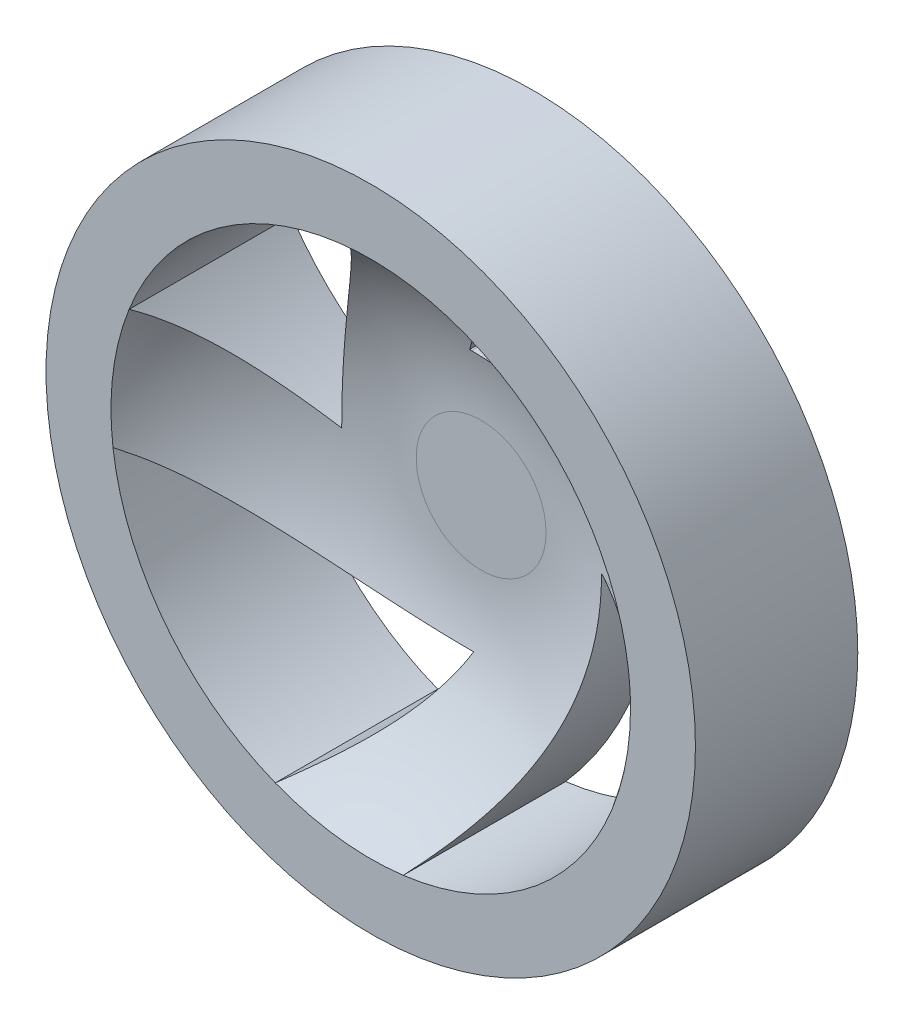
from build123d import *

# Parameters (mm, degrees)
SKETCH1_R           = 50
BOSS_EXTRUDE1_DEPTH = 25


with BuildPart() as part:
    # Sketch1 → Boss-Extrude1 (new body)
    with BuildSketch(Plane.XY):
        Circle(SKETCH1_R)
        with BuildLine():
            ThreePointArc((0, -20), (0.156254769, -19.999389602), (0.3125, -19.997558445))
            ThreePointArc((0.3125, -19.997558445), (-6.078152761, -29.5687044), (-14.6875, -37.205877812))
            ThreePointArc((-14.6875, -37.205877812), (-31.597964307, -24.526896495), (-39.686269666, -5))
            ThreePointArc((-39.686269666, -5), (-21.213203436, -16.124860802), (0, -20))
        make_face(mode=Mode.SUBTRACT)
        with BuildLine():
            ThreePointArc((-5, 39.686269666), (-16.124860802, 21.213203436), (-20, 0))
            ThreePointArc((-20, 0), (-19.999389602, -0.156254769), (-19.997558445, -0.3125))
            ThreePointArc((-19.997558445, -0.3125), (-29.5687044, 6.078152761), (-37.205877812, 14.6875))
            ThreePointArc((-37.205877812, 14.6875), (-24.526896495, 31.597964307), (-5, 39.686269666))
        make_face(mode=Mode.SUBTRACT)
        with BuildLine():
            ThreePointArc((39.686269666, 5), (21.213203436, 16.124860802), (0, 20))
            ThreePointArc((0, 20), (-0.156254769, 19.999389602), (-0.3125, 19.997558445))
            ThreePointArc((-0.3125, 19.997558445), (6.078152761, 29.5687044), (14.6875, 37.205877812))
            ThreePointArc((14.6875, 37.205877812), (31.597964307, 24.526896495), (39.686269666, 5))
        make_face(mode=Mode.SUBTRACT)
        with BuildLine():
            ThreePointArc((5, -39.686269666), (16.124860802, -21.213203436), (20, 0))
            ThreePointArc((20, 0), (19.999389602, 0.156254769), (19.997558445, 0.3125))
            ThreePointArc((19.997558445, 0.3125), (29.5687044, -6.078152761), (37.205877812, -14.6875))
            ThreePointArc((37.205877812, -14.6875), (24.526896495, -31.597964307), (5, -39.686269666))
        make_face(mode=Mode.SUBTRACT)
    extrude(amount=BOSS_EXTRUDE1_DEPTH)

    # Sketch3 → Cut-Revolve4 (revolve, cut)
    with BuildSketch(Plane(origin=(0, 0, 0), x_dir=(0, 0, -1), z_dir=(1, 0, 0)), mode=Mode.PRIVATE) as cut_revolve4_sk:
        with BuildLine():
            Line((-25, 40), (-25, 0))
            Line((-25, 0), (-8, 0))
            Line((-8, 0), (-8, 10))
            ThreePointArc((-8, 10), (-12.549219528, 27.238775601), (-25, 40))
        make_face()
    revolve(cut_revolve4_sk.sketch.rotate(Axis((0, 0, 25), (0, 0, -1)), 90), axis=Axis((0, 0, 25), (0, 0, -1)), mode=Mode.SUBTRACT)


solid = part.part
